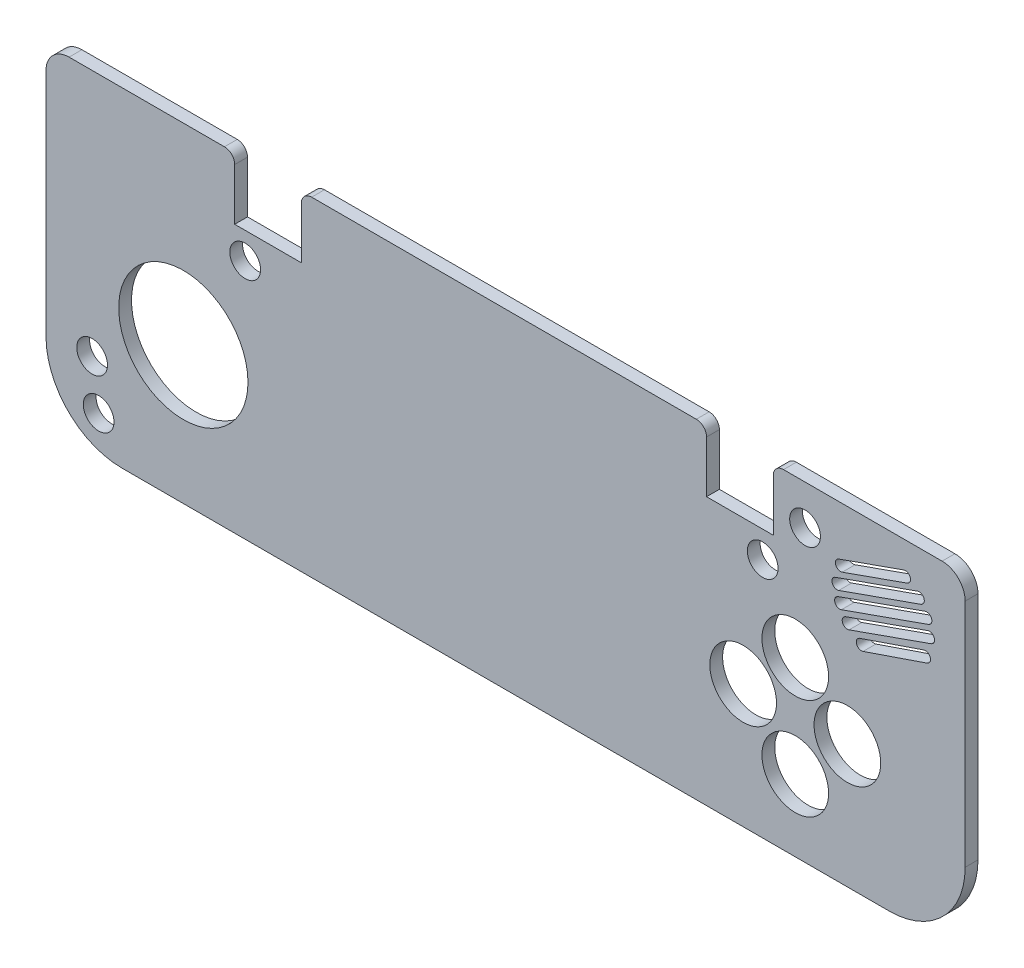
from build123d import *

# Parameters (mm, degrees)
BOSS_EXTRU_1_DEPTH       = 2.5
ESQUISSE22_R             = 12.6
ENL_V_MAT_EXTRU_1_DEPTH  = 2.5
ESQUISSE23_R             = 3
ENL_V_MAT_EXTRU_2_DEPTH  = 2.5
ENL_V_MAT_EXTRU_3_DEPTH  = 2.5
ESQUISSE25_W             = 13
ESQUISSE25_H             = 3.371774097
ENL_V_MAT_EXTRU_4_DEPTH  = 2.5
CONG_1_R                 = 2
ESQUISSE26_R             = 6.5
ENL_V_MAT_EXTRU_5_DEPTH  = 2.5
ESQUISSE27_R             = 6.5
ENL_V_MAT_EXTRU_6_DEPTH  = 2.5
ESQUISSE30_W             = 13
ESQUISSE30_H             = 3.36
ENL_V_MAT_EXTRU_7_DEPTH  = 2.5
CONG_2_R                 = 2
ESQUISSE31_R             = 3
ENL_V_MAT_EXTRU_8_DEPTH  = 2.5
ENL_V_MAT_EXTRU_9_DEPTH  = 2.5
ESQUISSE33_R             = 3
ENL_V_MAT_EXTRU_10_DEPTH = 10
ESQUISSE34_R             = 3
ENL_V_MAT_EXTRU_11_DEPTH = 10


with BuildPart() as part:
    # Esquisse20 → Boss.-Extru.1 (new body)
    with BuildSketch(Plane.XY):
        with BuildLine():
            Line((14.8, -2), (164.37, -2))
            ThreePointArc((164.37, -2), (174.835180362, 2.334819638), (179.17, 12.8))
            Line((179.17, 12.8), (179.17, 57.73))
            ThreePointArc((179.17, 57.73), (177.851980515, 60.911980515), (174.67, 62.23))
            Line((174.67, 62.23), (4.5, 62.23))
            ThreePointArc((4.5, 62.23), (1.318019485, 60.911980515), (0, 57.73))
            Line((0, 57.73), (0, 12.8))
            ThreePointArc((0, 12.8), (4.334819638, 2.334819638), (14.8, -2))
        make_face()
    extrude(amount=BOSS_EXTRU_1_DEPTH)

    # Esquisse22 → Enlèv. mat.-Extru.1 (cut)
    with BuildSketch(Plane.XY.offset(2.5)):
        with Locations((26.77, 24.77)):
            Circle(ESQUISSE22_R)
    extrude(amount=-ENL_V_MAT_EXTRU_1_DEPTH, mode=Mode.SUBTRACT)

    # Esquisse23 → Enlèv. mat.-Extru.2 (cut)
    with BuildSketch(Plane.XY.offset(2.5)):
        with Locations((8.99, 13.97)):
            Circle(ESQUISSE23_R)
    extrude(amount=-ENL_V_MAT_EXTRU_2_DEPTH, mode=Mode.SUBTRACT)

    # Esquisse24 → Enlèv. mat.-Extru.3 (cut)
    with BuildSketch(Plane.XY.offset(2.5)):
        Polygon((36.78, 58.87), (36.78, 50.15), (49.78, 50.15), align=None)
        Polygon((49.78, 58.87), (49.78, 50.15), (36.78, 58.87), align=None)
    extrude(amount=-ENL_V_MAT_EXTRU_3_DEPTH, mode=Mode.SUBTRACT)

    # Esquisse25 → Enlèv. mat.-Extru.4 (cut)
    with BuildSketch(Plane.XY.offset(2.5)):
        with Locations((43.28, 60.555887049)):
            Rectangle(ESQUISSE25_W, ESQUISSE25_H)
    extrude(amount=-ENL_V_MAT_EXTRU_4_DEPTH, mode=Mode.SUBTRACT)

    # Congé1
    cong_1_edges = [part.edges().sort_by_distance(p)[0] for p in [
        (49.78, 62.23, 1.25),
        (36.78, 62.23, 1.25),
    ]]
    fillet(cong_1_edges, radius=CONG_1_R)

    # Esquisse26 → Enlèv. mat.-Extru.5 (cut)
    with BuildSketch(Plane.XY.offset(2.5)):
        with Locations((156.21, 22.13)):
            Circle(ESQUISSE26_R)
    extrude(amount=-ENL_V_MAT_EXTRU_5_DEPTH, mode=Mode.SUBTRACT)

    # Esquisse27 → Enlèv. mat.-Extru.6 (cut)
    with BuildSketch(Plane.XY.offset(2.5)):
        with Locations((146.05, 11.97)):
            Circle(ESQUISSE27_R)
        with Locations((135.89, 22.13)):
            Circle(ESQUISSE27_R)
        with Locations((146.05, 31.65)):
            Circle(ESQUISSE27_R)
    extrude(amount=-ENL_V_MAT_EXTRU_6_DEPTH, mode=Mode.SUBTRACT)

    # Esquisse30 → Enlèv. mat.-Extru.7 (cut)
    with BuildSketch(Plane.XY.offset(2.5)):
        with Locations((135.26, 60.55)):
            Rectangle(ESQUISSE30_W, ESQUISSE30_H)
        Polygon((141.76, 58.87), (128.76, 58.87), (135.26, 54.51), align=None)
        Polygon((135.26, 54.51), (128.76, 58.87), (128.76, 50.15), align=None)
        Polygon((141.76, 50.15), (135.26, 54.51), (128.76, 50.15), align=None)
        Polygon((141.76, 58.87), (135.26, 54.51), (141.76, 50.15), align=None)
    extrude(amount=-ENL_V_MAT_EXTRU_7_DEPTH, mode=Mode.SUBTRACT)

    # Congé2
    cong_2_edges = [part.edges().sort_by_distance(p)[0] for p in [
        (128.76, 62.23, 1.25),
        (141.76, 62.23, 1.25),
    ]]
    fillet(cong_2_edges, radius=CONG_2_R)

    # Esquisse31 → Enlèv. mat.-Extru.8 (cut)
    with BuildSketch(Plane.XY.offset(2.5)):
        with Locations((147.96, 54.51)):
            Circle(ESQUISSE31_R)
        with Locations((139.7, 44.99)):
            Circle(ESQUISSE31_R)
    extrude(amount=-ENL_V_MAT_EXTRU_8_DEPTH, mode=Mode.SUBTRACT)

    # Esquisse32 → Enlèv. mat.-Extru.9 (cut)
    with BuildSketch(Plane.XY.offset(2.5)):
        with BuildLine():
            Line((172.018614708, 50.217190958), (155.048051959, 44.217190958))
            ThreePointArc((155.048051959, 44.217190958), (153.771909584, 44.826666667), (154.381385292, 46.102809042))
            Line((154.381385292, 46.102809042), (171.351948041, 52.102809042))
            ThreePointArc((171.351948041, 52.102809042), (172.628090416, 51.493333333), (172.018614708, 50.217190958))
        make_face()
        with BuildLine():
            Line((153.866666667, 49.102809042), (169.866666667, 54.759663291))
            ThreePointArc((169.866666667, 54.759663291), (171.142809042, 54.150187583), (170.533333333, 52.874045208))
            Line((170.533333333, 52.874045208), (154.533333333, 47.217190958))
            ThreePointArc((154.533333333, 47.217190958), (153.257190958, 47.826666667), (153.866666667, 49.102809042))
        make_face()
        with BuildLine():
            Line((154.542111346, 52.523595314), (167.191221987, 56.995731269))
            ThreePointArc((167.191221987, 56.995731269), (168.467364362, 56.38625556), (167.857888654, 55.110113185))
            Line((167.857888654, 55.110113185), (155.208778013, 50.63797723))
            ThreePointArc((155.208778013, 50.63797723), (153.932635638, 51.247452939), (154.542111346, 52.523595314))
        make_face()
        with BuildLine():
            Line((155.866666667, 43.445954792), (171.866666667, 49.102809042))
            ThreePointArc((171.866666667, 49.102809042), (173.142809042, 48.493333333), (172.533333333, 47.217190958))
            Line((172.533333333, 47.217190958), (156.533333333, 41.560336709))
            ThreePointArc((156.533333333, 41.560336709), (155.257190958, 42.169812417), (155.866666667, 43.445954792))
        make_face()
        with BuildLine():
            Line((158.617948097, 41.177385778), (171.09857492, 45.446217537))
            ThreePointArc((171.09857492, 45.446217537), (172.368388344, 44.823663229), (171.745834035, 43.553849804))
            Line((171.745834035, 43.553849804), (159.265207213, 39.285018045))
            ThreePointArc((159.265207213, 39.285018045), (157.995393788, 39.907572354), (158.617948097, 41.177385778))
        make_face()
    extrude(amount=-ENL_V_MAT_EXTRU_9_DEPTH, mode=Mode.SUBTRACT)

    # Esquisse33 → Enlèv. mat.-Extru.10 (cut)
    with BuildSketch(Plane.XY.offset(2.5)):
        with Locations((38.83, 44.99)):
            Circle(ESQUISSE33_R)
    extrude(amount=-ENL_V_MAT_EXTRU_10_DEPTH, mode=Mode.SUBTRACT)

    # Esquisse34 → Enlèv. mat.-Extru.11 (cut)
    with BuildSketch(Plane.XY.offset(2.5)):
        with Locations((10.26, 4.99)):
            Circle(ESQUISSE34_R)
    extrude(amount=-ENL_V_MAT_EXTRU_11_DEPTH, mode=Mode.SUBTRACT)


solid = part.part
